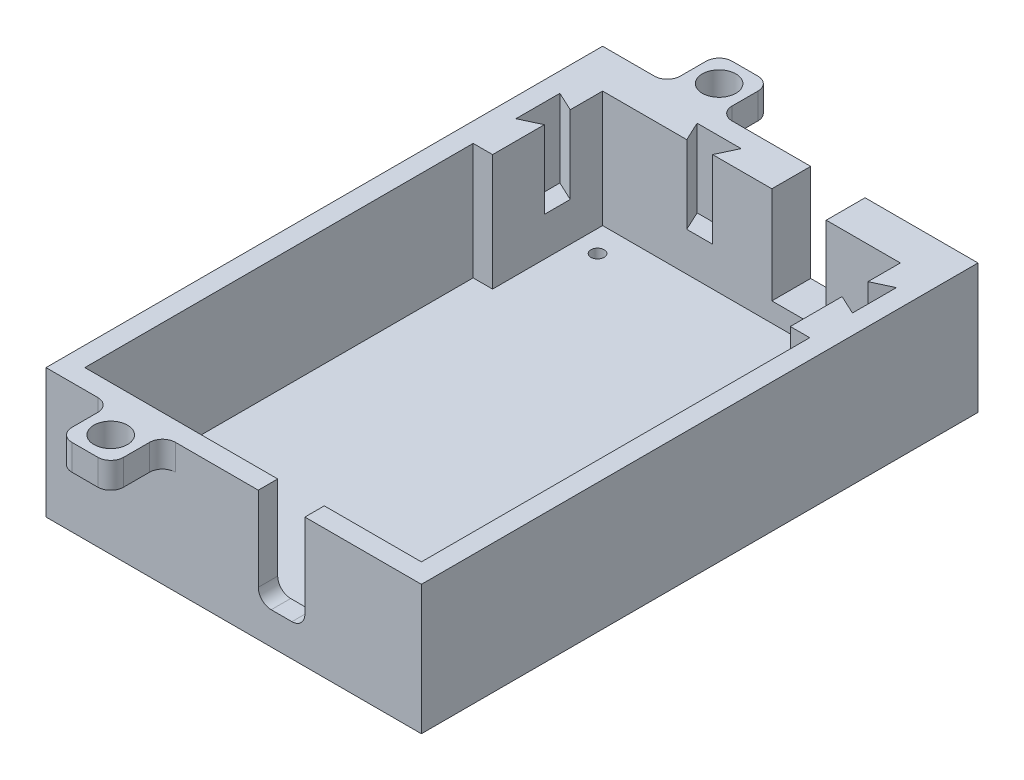
from build123d import *

# Parameters (mm, degrees)
SKETCH1_W               = 66.04
SKETCH1_H               = 101.6
BASE_EXTRUDE_DEPTH      = 2.54
SKETCH2_W               = 73.66
SKETCH2_H               = 109.22
SKETCH2_W_2             = 66.04
SKETCH2_H_2             = 101.6
WALLS_DEPTH             = 25.4
BUTTON_GUIDE_DEPTH      = 22.86
SKETCH4_R               = 1.3
CUT_EXTRUDE1_DEPTH      = 129.502413207
HARD_STOP_DEPTH         = 7.62
SKETCH6_W               = 9.144
SKETCH6_H               = 3.81
SKETCH6_W_2             = 10.668
SKETCH6_H_2             = 7.62
ELECTRONICS_HOLES_DEPTH = 19.05
FILLET1_R               = 2.54
SKETCH7_W               = 10.16
SKETCH7_H               = 5.08
BOSS_EXTRUDE1_DEPTH     = 10.16
SKETCH8_W               = 10.16
SKETCH8_H               = 5.08
BOSS_EXTRUDE2_DEPTH     = 10.16
SKETCH9_R               = 3.302
CUT_EXTRUDE2_DEPTH      = 138.406722543
FILLET2_R               = 2.54


with BuildPart() as part:
    # Sketch1 → Base Extrude (new body)
    with BuildSketch(Plane(origin=(0, 0, 0), x_dir=(1, 0, 0), z_dir=(0, 1, 0))):
        with Locations((33.02, 50.8)):
            Rectangle(SKETCH1_W, SKETCH1_H)
    extrude(amount=BASE_EXTRUDE_DEPTH)

    # Sketch2 → Walls (add)
    with BuildSketch(Plane.XZ):
        with Locations((33.02, -50.8)):
            Rectangle(SKETCH2_W, SKETCH2_H)
        with Locations((33.02, -50.8)):
            Rectangle(SKETCH2_W_2, SKETCH2_H_2, mode=Mode.SUBTRACT)
    extrude(amount=-WALLS_DEPTH)

    # Sketch3 → Button Guide (add)
    with BuildSketch(Plane(origin=(0, 25.4, 0), x_dir=(1, 0, 0), z_dir=(0, 1, 0))):
        Polygon((3.81, 86.36), (0, 84.583367822), (0, 76.2), (3.81, 76.2), align=None)
        Polygon((18.543367822, 101.6), (0, 101.6), (0, 93.216632178), (3.81, 91.44), (3.81, 97.79), (20.32, 97.79), align=None)
        Polygon((66.04, 101.6), (27.176632178, 101.6), (25.4, 97.79), (62.23, 97.79), (62.23, 91.44), (66.04, 93.216632178), align=None)
        Polygon((66.04, 76.2), (66.04, 84.583367822), (62.23, 86.36), (62.23, 76.2), align=None)
    extrude(amount=-BUTTON_GUIDE_DEPTH)

    # Sketch4 → Cut-Extrude1 (cut, through all)
    with BuildSketch(Plane(origin=(0, 2.54, 0), x_dir=(1, 0, 0), z_dir=(0, 1, 0))):
        with Locations(Location((8.0645, 92.542598833, 0), (0, 0, 270))):
            Circle(SKETCH4_R)
        with Locations(Location((57.9755, 92.542598833, 0), (0, 0, 270))):
            Circle(SKETCH4_R)
        with Locations(Location((8.0645, 7.452598833, 0), (0, 0, 270))):
            Circle(SKETCH4_R)
        with Locations(Location((57.9755, 7.452598833, 0), (0, 0, 270))):
            Circle(SKETCH4_R)
    extrude(amount=-CUT_EXTRUDE1_DEPTH, mode=Mode.SUBTRACT)

    # Sketch5 → Hard stop (add)
    with BuildSketch(Plane(origin=(0, 2.54, 0), x_dir=(1, 0, 0), z_dir=(0, 1, 0))):
        Polygon((0, 93.216632178), (0, 84.583367822), (3.81, 86.36), (3.81, 91.44), align=None)
        Polygon((18.543367822, 101.6), (27.176632178, 101.6), (25.4, 97.79), (20.32, 97.79), align=None)
        Polygon((62.23, 91.44), (66.04, 93.216632178), (66.04, 84.583367822), (62.23, 86.36), align=None)
    extrude(amount=HARD_STOP_DEPTH)

    # Sketch6 → Electronics Holes (cut)
    with BuildSketch(Plane(origin=(0, 25.4, 0), x_dir=(1, 0, 0), z_dir=(0, 1, 0))):
        with Locations((42.418, -1.905)):
            Rectangle(SKETCH6_W, SKETCH6_H)
        with Locations((42.3545, 101.6)):
            Rectangle(SKETCH6_W_2, SKETCH6_H_2)
    extrude(amount=-ELECTRONICS_HOLES_DEPTH, mode=Mode.SUBTRACT)

    # Fillet1
    fillet1_edges = [part.edges().sort_by_distance(p)[0] for p in [
        (37.846, 6.35, 1.905),
        (46.99, 6.35, 1.905),
    ]]
    fillet(fillet1_edges, radius=FILLET1_R)

    # Sketch7 → Boss-Extrude1 (add)
    with BuildSketch(Plane.XY.offset(3.81)):
        with Locations((13.97, 22.86)):
            Rectangle(SKETCH7_W, SKETCH7_H)
    extrude(amount=BOSS_EXTRUDE1_DEPTH)

    # Sketch8 → Boss-Extrude2 (add)
    with BuildSketch(Plane(origin=(0, 0, -105.41), x_dir=(-1, 0, 0), z_dir=(0, 0, -1))):
        with Locations((-13.97, 22.86)):
            Rectangle(SKETCH8_W, SKETCH8_H)
    extrude(amount=BOSS_EXTRUDE2_DEPTH)

    # Sketch9 → Cut-Extrude2 (cut, through all)
    with BuildSketch(Plane(origin=(0, 25.4, 0), x_dir=(1, 0, 0), z_dir=(0, 1, 0))):
        with Locations(Location((13.97, 110.49, 0), (0, 0, 270))):
            Circle(SKETCH9_R)
        with Locations(Location((13.97, -8.89, 0), (0, 0, 270))):
            Circle(SKETCH9_R)
    extrude(amount=-CUT_EXTRUDE2_DEPTH, mode=Mode.SUBTRACT)

    # Fillet2
    fillet2_edges = [part.edges().sort_by_distance(p)[0] for p in [
        (8.89, 22.86, 3.81),
        (19.05, 22.86, 3.81),
        (8.89, 22.86, 13.97),
        (19.05, 22.86, 13.97),
        (19.05, 22.86, -105.41),
        (8.89, 22.86, -105.41),
        (19.05, 22.86, -115.57),
        (8.89, 22.86, -115.57),
    ]]
    fillet(fillet2_edges, radius=FILLET2_R)


solid = part.part
